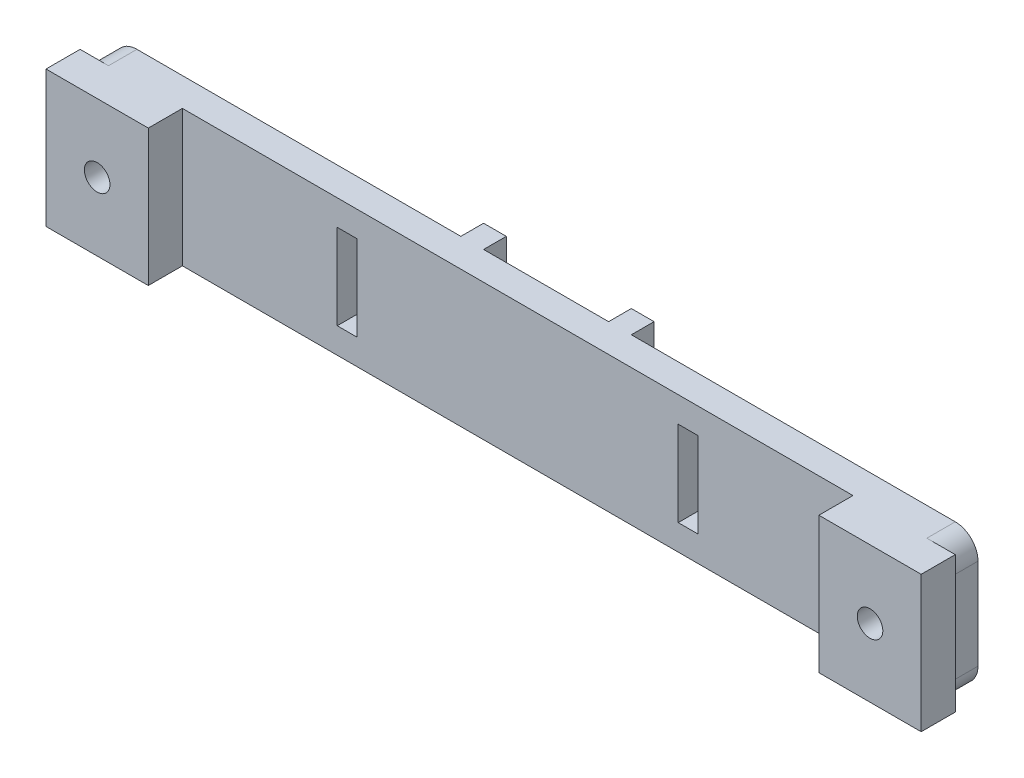
from build123d import *

# Parameters (mm, degrees)
BOSS_EXTRUDE1_DEPTH = 5
SKETCH2_W           = 18
SKETCH2_H           = 24
BOSS_EXTRUDE2_DEPTH = 6
SKETCH3_R           = 2.25
CUT_EXTRUDE1_DEPTH  = 79.70196948
SKETCH4_W           = 3.5
SKETCH4_H           = 15
CUT_EXTRUDE2_DEPTH  = 79.160092119
SKETCH5_W           = 4
SKETCH5_H           = 24
BOSS_EXTRUDE3_DEPTH = 4


with BuildPart() as part:
    # Sketch1 → Boss-Extrude1 (new body)
    with BuildSketch(Plane.XY):
        with BuildLine():
            Line((-72, -12), (72, -12))
            ThreePointArc((72, -12), (74.828427125, -10.828427125), (76, -8))
            Line((76, -8), (76, 8))
            ThreePointArc((76, 8), (74.828427125, 10.828427125), (72, 12))
            Line((72, 12), (-72, 12))
            ThreePointArc((-72, 12), (-74.828427125, 10.828427125), (-76, 8))
            Line((-76, 8), (-76, -8))
            ThreePointArc((-76, -8), (-74.828427125, -10.828427125), (-72, -12))
        make_face()
    extrude(amount=BOSS_EXTRUDE1_DEPTH)

    # Sketch2 → Boss-Extrude2 (add)
    with BuildSketch(Plane.XY.offset(5)):
        with Locations((-68, 0)):
            Rectangle(SKETCH2_W, SKETCH2_H)
        with Locations((68, 0)):
            Rectangle(SKETCH2_W, SKETCH2_H)
    extrude(amount=BOSS_EXTRUDE2_DEPTH)

    # Sketch3 → Cut-Extrude1 (cut, through all)
    with BuildSketch(Plane.XY.offset(11)):
        with Locations((-68, 0)):
            Circle(SKETCH3_R)
        with Locations((68, 0)):
            Circle(SKETCH3_R)
    extrude(amount=-CUT_EXTRUDE1_DEPTH, mode=Mode.SUBTRACT)

    # Sketch4 → Cut-Extrude2 (cut, through all)
    with BuildSketch(Plane.XY.offset(5)):
        with Locations((-30, 0)):
            Rectangle(SKETCH4_W, SKETCH4_H)
        with Locations((30, 0)):
            Rectangle(SKETCH4_W, SKETCH4_H)
    extrude(amount=-CUT_EXTRUDE2_DEPTH, mode=Mode.SUBTRACT)

    # Sketch5 → Boss-Extrude3 (add)
    with BuildSketch(Plane.XY):
        with Locations((-13, 0)):
            Rectangle(SKETCH5_W, SKETCH5_H)
        with Locations((13, 0)):
            Rectangle(SKETCH5_W, SKETCH5_H)
    extrude(amount=-BOSS_EXTRUDE3_DEPTH)


solid = part.part
